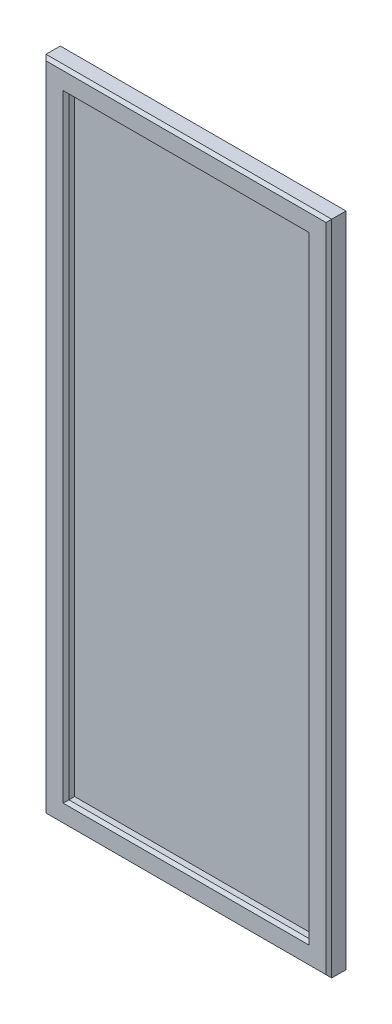
from build123d import *

# Parameters (mm, degrees)
SKETCH_1_W      = 1000
SKETCH_1_H      = 2300
SKETCH_1_W_2    = 840
SKETCH_1_H_2    = 2140
EXTRUDE_1_DEPTH = 60
CHAMFER_1_SIZE  = 10
EXTRUDE_START   = -20
SKETCH_2_W      = 900.373669922
SKETCH_2_H      = 2217.936834282
EXTRUDE_2_DEPTH = 10


with BuildPart() as part:
    # Эскиз1 → Бобышка-Вытянуть1 (new body)
    with BuildSketch(Plane.XY):
        with Locations((500, 1150)):
            Rectangle(SKETCH_1_W, SKETCH_1_H)
        with Locations((500, 1150)):
            Rectangle(SKETCH_1_W_2, SKETCH_1_H_2, mode=Mode.SUBTRACT)
    extrude(amount=EXTRUDE_1_DEPTH)

    # Фаска1
    chamfer_1_edges = [part.edges().sort_by_distance(p)[0] for p in [
        (1000, 1150, 60),
        (500, 80, 60),
        (500, 2300, 60),
        (920, 1150, 60),
        (500, 2220, 60),
        (80, 1150, 60),
        (0, 1150, 60),
        (500, 0, 60),
    ]]
    chamfer(chamfer_1_edges, length=CHAMFER_1_SIZE)


with BuildPart() as body_2:
    # Эскиз2 → Бобышка-Вытянуть2 (new body)
    with BuildSketch(Plane(origin=(0, 0, 0), x_dir=(-1, 0, 0), z_dir=(0, 0, -1)).offset(EXTRUDE_START)):
        with Locations((-506.85184074, 1157.397135367)):
            Rectangle(SKETCH_2_W, SKETCH_2_H)
    extrude(amount=-EXTRUDE_2_DEPTH)


solid = Compound([part.part, body_2.part])
